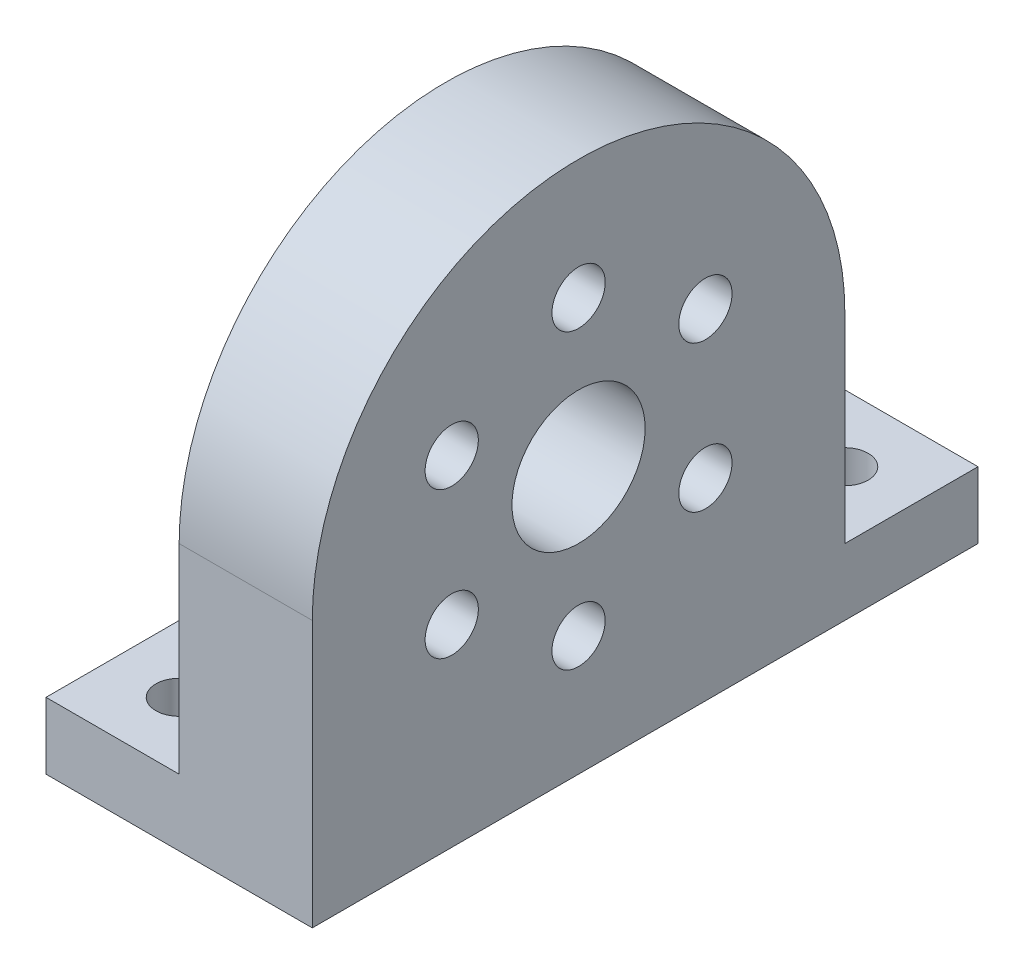
from build123d import *

# Parameters (mm, degrees)
SKETCH1_R                                       = 2
SKETCH1_R_2                                     = 5
BOSS_EXTRUDE1_DEPTH                             = 10
CSK_FOR_M3_FLAT_HEAD_MACHINE_SCREW1_D           = 3.4
CSK_FOR_M3_FLAT_HEAD_MACHINE_SCREW1_CSINK_D     = 6.3
CSK_FOR_M3_FLAT_HEAD_MACHINE_SCREW1_CSINK_ANGLE = 90
BOSS_EXTRUDE2_DEPTH                             = 5
F_3_0MM_DOWEL_HOLE1_D                           = 3.5


with BuildPart() as part:
    # Sketch1 → Boss-Extrude1 (new body)
    with BuildSketch(Plane(origin=(0, 0, 0), x_dir=(0, 0, -1), z_dir=(1, 0, 0))):
        with BuildLine():
            Line((30, -15), (20, -15))
            Line((20, -15), (20, 0))
            ThreePointArc((20, 0), (0, 20), (-20, 0))
            Line((-20, 0), (-20, -15))
            Line((-20, -15), (-20, -20))
            Line((-20, -20), (-15.856579477, -20))
            Line((-15.856579477, -20), (9.951007048, -20))
            Line((9.951007048, -20), (17.640087429, -20))
            Line((17.640087429, -20), (30, -20))
            Line((30, -20), (30, -15))
        make_face()
        with Locations((-9.526279442, -5.5)):
            Circle(SKETCH1_R, mode=Mode.SUBTRACT)
        with Locations((0, -11)):
            Circle(SKETCH1_R, mode=Mode.SUBTRACT)
        with Locations((9.526279442, -5.5)):
            Circle(SKETCH1_R, mode=Mode.SUBTRACT)
        with Locations((-9.526279442, 5.5)):
            Circle(SKETCH1_R, mode=Mode.SUBTRACT)
        Circle(SKETCH1_R_2, mode=Mode.SUBTRACT)
        with Locations((9.526279442, 5.5)):
            Circle(SKETCH1_R, mode=Mode.SUBTRACT)
        with Locations((0, 11)):
            Circle(SKETCH1_R, mode=Mode.SUBTRACT)
    extrude(amount=BOSS_EXTRUDE1_DEPTH)

    # CSK for M3 Flat Head Machine Screw1 (through all)
    with Locations(Plane.ZY):
        with Locations((0, 11), (9.526279442, 5.5), (9.526279442, -5.5), (0, -11), (-9.526279442, -5.5), (-9.526279442, 5.5)):
            CounterSinkHole(CSK_FOR_M3_FLAT_HEAD_MACHINE_SCREW1_D / 2, CSK_FOR_M3_FLAT_HEAD_MACHINE_SCREW1_CSINK_D / 2, counter_sink_angle=CSK_FOR_M3_FLAT_HEAD_MACHINE_SCREW1_CSINK_ANGLE)

    # Sketch6 → Boss-Extrude2 (add)
    with BuildSketch(Plane.XZ.offset(20)):
        Polygon((0, 20), (-10, 20), (-10, 10), (0, 10), (10, 10), (10, 20), align=None)
    extrude(amount=-BOSS_EXTRUDE2_DEPTH)

    # Ø3.0mm Dowel Hole1 (through all)
    with Locations(Plane(origin=(5, -15, -25), x_dir=(0, 0, 1), z_dir=(0, 1, 0))):
        with Locations((0, 0), (40, -10)):
            Hole(F_3_0MM_DOWEL_HOLE1_D / 2)


solid = part.part
